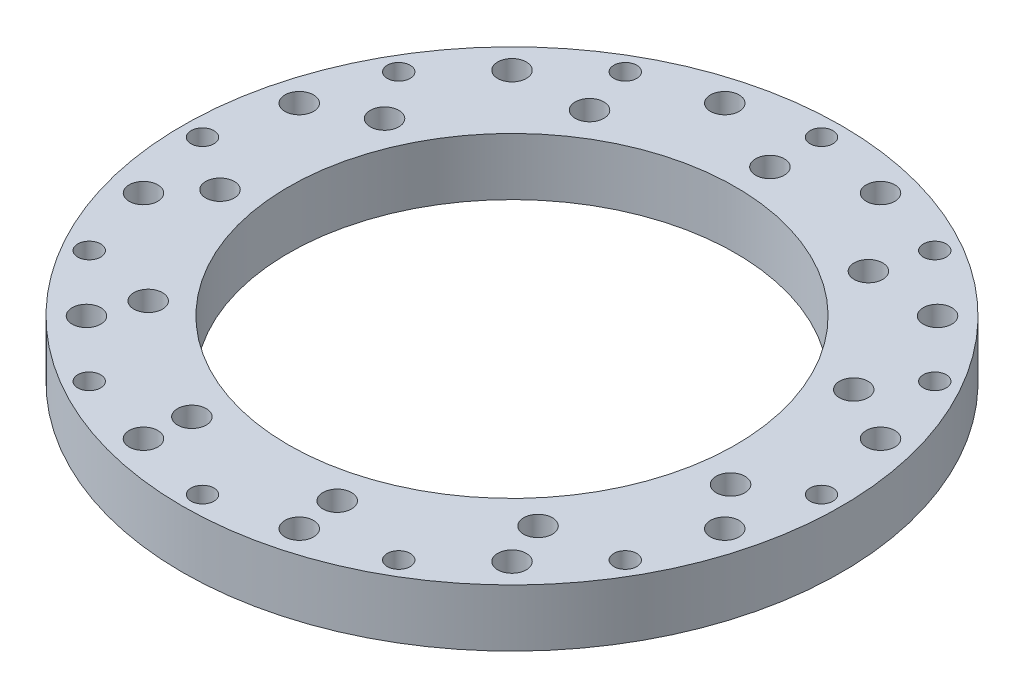
from build123d import *

# Parameters (mm, degrees)
SKETCH1_R           = 57.5
SKETCH1_R_2         = 39
SKETCH1_R_3         = 2
SKETCH1_R_4         = 2.5
BOSS_EXTRUDE1_DEPTH = 10
SKETCH2_R           = 2.5
CUT_EXTRUDE1_DEPTH  = 10
SKETCH4_R           = 5
SKETCH4_R_2         = 2.5
BOSS_EXTRUDE3_DEPTH = 0.4


with BuildPart() as part:
    # Sketch1 → Boss-Extrude1 (new body)
    with BuildSketch(Plane(origin=(0, 0, 0), x_dir=(1, 0, 0), z_dir=(0, 1, 0))):
        with Locations(Location((0, 0, 0), (0, 0, 270))):
            Circle(SKETCH1_R)
        with Locations(Location((0, 0, 0), (0, 0, 270))):
            Circle(SKETCH1_R_2, mode=Mode.SUBTRACT)
        with Locations(Location((0, 54, 0), (0, 0, 270))):
            Circle(SKETCH1_R_3, mode=Mode.SUBTRACT)
        with Locations(Location((27, 46.765371804, 0), (0, 0, 270))):
            Circle(SKETCH1_R_3, mode=Mode.SUBTRACT)
        with Locations(Location((46.765371804, 27, 0), (0, 0, 270))):
            Circle(SKETCH1_R_3, mode=Mode.SUBTRACT)
        with Locations(Location((54, 0, 0), (0, 0, 270))):
            Circle(SKETCH1_R_3, mode=Mode.SUBTRACT)
        with Locations(Location((46.765371804, -27, 0), (0, 0, 270))):
            Circle(SKETCH1_R_3, mode=Mode.SUBTRACT)
        with Locations(Location((27, -46.765371804, 0), (0, 0, 270))):
            Circle(SKETCH1_R_3, mode=Mode.SUBTRACT)
        with Locations(Location((0, -54, 0), (0, 0, 270))):
            Circle(SKETCH1_R_3, mode=Mode.SUBTRACT)
        with Locations(Location((-27, -46.765371804, 0), (0, 0, 270))):
            Circle(SKETCH1_R_3, mode=Mode.SUBTRACT)
        with Locations(Location((-46.765371804, -27, 0), (0, 0, 270))):
            Circle(SKETCH1_R_3, mode=Mode.SUBTRACT)
        with Locations(Location((-54, 0, 0), (0, 0, 270))):
            Circle(SKETCH1_R_3, mode=Mode.SUBTRACT)
        with Locations(Location((-46.765371804, 27, 0), (0, 0, 270))):
            Circle(SKETCH1_R_3, mode=Mode.SUBTRACT)
        with Locations(Location((-27, 46.765371804, 0), (0, 0, 270))):
            Circle(SKETCH1_R_3, mode=Mode.SUBTRACT)
        with Locations(Location((13.587999868, 50.71110588, 0), (0, 0, 270))):
            Circle(SKETCH1_R_4, mode=Mode.SUBTRACT)
        with Locations(Location((37.123106012, 37.123106012, 0), (0, 0, 270))):
            Circle(SKETCH1_R_4, mode=Mode.SUBTRACT)
        with Locations(Location((50.71110588, 13.587999868, 0), (0, 0, 270))):
            Circle(SKETCH1_R_4, mode=Mode.SUBTRACT)
        with Locations(Location((50.71110588, -13.587999868, 0), (0, 0, 270))):
            Circle(SKETCH1_R_4, mode=Mode.SUBTRACT)
        with Locations(Location((37.123106012, -37.123106012, 0), (0, 0, 270))):
            Circle(SKETCH1_R_4, mode=Mode.SUBTRACT)
        with Locations(Location((13.587999868, -50.71110588, 0), (0, 0, 270))):
            Circle(SKETCH1_R_4, mode=Mode.SUBTRACT)
        with Locations(Location((-13.587999868, -50.71110588, 0), (0, 0, 270))):
            Circle(SKETCH1_R_4, mode=Mode.SUBTRACT)
        with Locations(Location((-37.123106012, -37.123106012, 0), (0, 0, 270))):
            Circle(SKETCH1_R_4, mode=Mode.SUBTRACT)
        with Locations(Location((-50.71110588, -13.587999868, 0), (0, 0, 270))):
            Circle(SKETCH1_R_4, mode=Mode.SUBTRACT)
        with Locations(Location((-50.71110588, 13.587999868, 0), (0, 0, 270))):
            Circle(SKETCH1_R_4, mode=Mode.SUBTRACT)
        with Locations(Location((-37.123106012, 37.123106012, 0), (0, 0, 270))):
            Circle(SKETCH1_R_4, mode=Mode.SUBTRACT)
        with Locations(Location((-13.587999868, 50.71110588, 0), (0, 0, 270))):
            Circle(SKETCH1_R_4, mode=Mode.SUBTRACT)
    extrude(amount=BOSS_EXTRUDE1_DEPTH)

    # Sketch2 → Cut-Extrude1 (cut)
    with BuildSketch(Plane(origin=(0, 10, 0), x_dir=(1, 0, 0), z_dir=(0, 1, 0))):
        with Locations(Location((0, 45, 0), (0, 0, 270))):
            Circle(SKETCH2_R)
        with Locations(Location((24.328836786, 37.856408977, 0), (0, 0, 270))):
            Circle(SKETCH2_R)
        with Locations(Location((40.933439791, 18.693675585, 0), (0, 0, 270))):
            Circle(SKETCH2_R)
        with Locations(Location((44.541964885, -6.404167722, 0), (0, 0, 270))):
            Circle(SKETCH2_R)
        with Locations(Location((34.008730846, -29.468733028, 0), (0, 0, 270))):
            Circle(SKETCH2_R)
        with Locations(Location((12.677965058, -43.177183813, 0), (0, 0, 270))):
            Circle(SKETCH2_R)
        with Locations(Location((-12.677965058, -43.177183813, 0), (0, 0, 270))):
            Circle(SKETCH2_R)
        with Locations(Location((-34.008730846, -29.468733028, 0), (0, 0, 270))):
            Circle(SKETCH2_R)
        with Locations(Location((-44.541964885, -6.404167722, 0), (0, 0, 270))):
            Circle(SKETCH2_R)
        with Locations(Location((-40.933439791, 18.693675585, 0), (0, 0, 270))):
            Circle(SKETCH2_R)
        with Locations(Location((-24.328836786, 37.856408977, 0), (0, 0, 270))):
            Circle(SKETCH2_R)
    extrude(amount=-CUT_EXTRUDE1_DEPTH, mode=Mode.SUBTRACT)

    # Sketch4 → Boss-Extrude3 (add)
    # profile 1 of 11: a face of its own
    with BuildSketch(Plane(origin=(0, 0, 0), x_dir=(1, 0, 0), z_dir=(0, 1, 0))):
        with Locations(Location((0, 45, 0), (0, 0, 270))):
            Circle(SKETCH4_R)
        with Locations(Location((0, 45, 0), (0, 0, 270))):
            Circle(SKETCH4_R_2, mode=Mode.SUBTRACT)
    # profile 2 of 11: a face of its own
    with BuildSketch(Plane(origin=(0, 0, 0), x_dir=(1, 0, 0), z_dir=(0, 1, 0))):
        with Locations(Location((24.328836786, 37.856408977, 0), (0, 0, 270))):
            Circle(SKETCH4_R)
        with Locations(Location((24.328836786, 37.856408977, 0), (0, 0, 270))):
            Circle(SKETCH4_R_2, mode=Mode.SUBTRACT)
    # profile 3 of 11: a face of its own
    with BuildSketch(Plane(origin=(0, 0, 0), x_dir=(1, 0, 0), z_dir=(0, 1, 0))):
        with Locations(Location((40.933439791, 18.693675585, 0), (0, 0, 270))):
            Circle(SKETCH4_R)
        with Locations(Location((40.933439791, 18.693675585, 0), (0, 0, 270))):
            Circle(SKETCH4_R_2, mode=Mode.SUBTRACT)
    # profile 4 of 11: a face of its own
    with BuildSketch(Plane(origin=(0, 0, 0), x_dir=(1, 0, 0), z_dir=(0, 1, 0))):
        with Locations(Location((44.541964885, -6.404167722, 0), (0, 0, 270))):
            Circle(SKETCH4_R)
        with Locations(Location((44.541964885, -6.404167722, 0), (0, 0, 270))):
            Circle(SKETCH4_R_2, mode=Mode.SUBTRACT)
    # profile 5 of 11: a face of its own
    with BuildSketch(Plane(origin=(0, 0, 0), x_dir=(1, 0, 0), z_dir=(0, 1, 0))):
        with Locations(Location((34.008730846, -29.468733028, 0), (0, 0, 270))):
            Circle(SKETCH4_R)
        with Locations(Location((34.008730846, -29.468733028, 0), (0, 0, 270))):
            Circle(SKETCH4_R_2, mode=Mode.SUBTRACT)
    # profile 6 of 11: a face of its own
    with BuildSketch(Plane(origin=(0, 0, 0), x_dir=(1, 0, 0), z_dir=(0, 1, 0))):
        with Locations(Location((12.677965058, -43.177183813, 0), (0, 0, 270))):
            Circle(SKETCH4_R)
        with Locations(Location((12.677965058, -43.177183813, 0), (0, 0, 270))):
            Circle(SKETCH4_R_2, mode=Mode.SUBTRACT)
    # profile 7 of 11: a face of its own
    with BuildSketch(Plane(origin=(0, 0, 0), x_dir=(1, 0, 0), z_dir=(0, 1, 0))):
        with Locations(Location((-12.677965058, -43.177183813, 0), (0, 0, 270))):
            Circle(SKETCH4_R)
        with Locations(Location((-12.677965058, -43.177183813, 0), (0, 0, 270))):
            Circle(SKETCH4_R_2, mode=Mode.SUBTRACT)
    # profile 8 of 11: a face of its own
    with BuildSketch(Plane(origin=(0, 0, 0), x_dir=(1, 0, 0), z_dir=(0, 1, 0))):
        with Locations(Location((-34.008730846, -29.468733028, 0), (0, 0, 270))):
            Circle(SKETCH4_R)
        with Locations(Location((-34.008730846, -29.468733028, 0), (0, 0, 270))):
            Circle(SKETCH4_R_2, mode=Mode.SUBTRACT)
    # profile 9 of 11: a face of its own
    with BuildSketch(Plane(origin=(0, 0, 0), x_dir=(1, 0, 0), z_dir=(0, 1, 0))):
        with Locations(Location((-44.541964885, -6.404167722, 0), (0, 0, 270))):
            Circle(SKETCH4_R)
        with Locations(Location((-44.541964885, -6.404167722, 0), (0, 0, 270))):
            Circle(SKETCH4_R_2, mode=Mode.SUBTRACT)
    # profile 10 of 11: a face of its own
    with BuildSketch(Plane(origin=(0, 0, 0), x_dir=(1, 0, 0), z_dir=(0, 1, 0))):
        with Locations(Location((-40.933439791, 18.693675585, 0), (0, 0, 270))):
            Circle(SKETCH4_R)
        with Locations(Location((-40.933439791, 18.693675585, 0), (0, 0, 270))):
            Circle(SKETCH4_R_2, mode=Mode.SUBTRACT)
    # profile 11 of 11: a face of its own
    with BuildSketch(Plane(origin=(0, 0, 0), x_dir=(1, 0, 0), z_dir=(0, 1, 0))):
        with Locations(Location((-24.328836786, 37.856408977, 0), (0, 0, 270))):
            Circle(SKETCH4_R)
        with Locations(Location((-24.328836786, 37.856408977, 0), (0, 0, 270))):
            Circle(SKETCH4_R_2, mode=Mode.SUBTRACT)
    extrude(amount=-BOSS_EXTRUDE3_DEPTH)


solid = part.part
